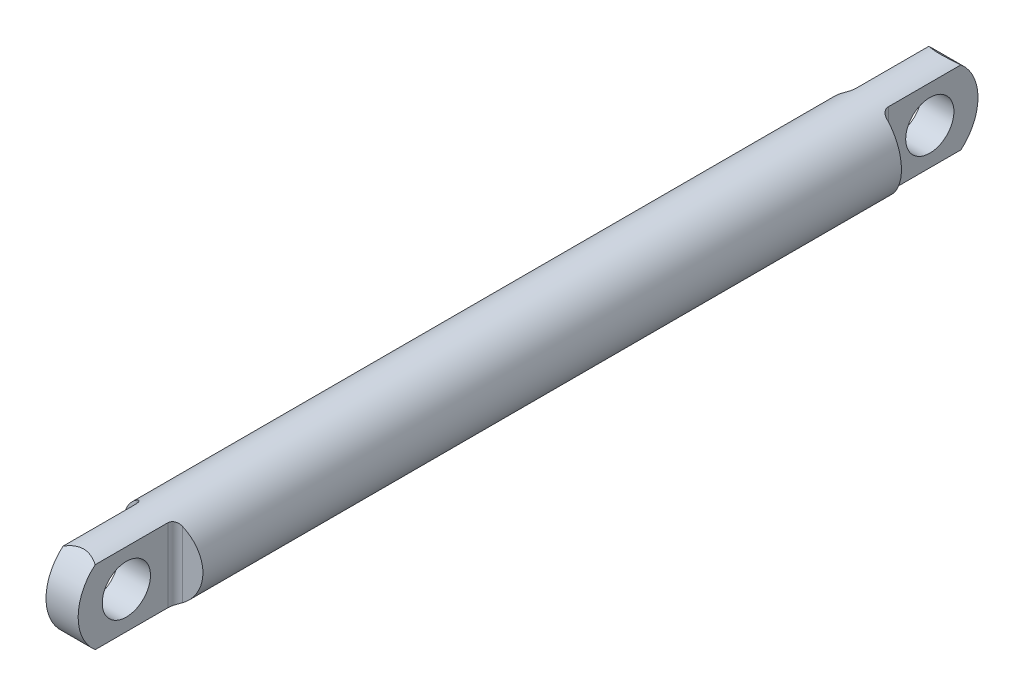
from build123d import *

# Parameters (mm, degrees)
SKETCH1_R            = 5
BOSS_EXTRUDE1_DEPTH  = 56
CUT_EXTRUDE2_DEPTH   = 57.444663167
CUT_EXTRUDE3_DEPTH   = 57.444663284
SKETCH8_R            = 3
CUT_EXTRUDE4_DEPTH   = 57.656862017
FILLET1_R            = 1
FILLET1_OF_MIRROR2_R = 1


with BuildPart() as part:
    # Sketch1 → Boss-Extrude1 (new, symmetric)
    with BuildSketch(Plane.XY):
        Circle(SKETCH1_R)
    extrude(amount=BOSS_EXTRUDE1_DEPTH, both=True)

    # Sketch6 → Cut-Extrude2 (cut, symmetric)
    with BuildSketch(Plane(origin=(0, 0, 0), x_dir=(0, 0, -1), z_dir=(1, 0, 0))):
        with BuildLine():
            Line((56, 0), (56, 5))
            Line((56, 5), (53.31662479, 5))
            ThreePointArc((53.31662479, 5), (55.286764074, 2.837274331), (56, 0))
        make_face()
        with BuildLine():
            Line((56, -5), (56, 0))
            ThreePointArc((56, 0), (55.286764074, -2.837274331), (53.31662479, -5))
            Line((53.31662479, -5), (56, -5))
        make_face()
    cut_extrude2 = extrude(amount=CUT_EXTRUDE2_DEPTH, both=True, mode=Mode.SUBTRACT)

    # Sketch7 → Cut-Extrude3 (cut, symmetric)
    with BuildSketch(Plane(origin=(0, 0, 0), x_dir=(1, 0, 0), z_dir=(0, 1, 0))):
        Polygon((-2, 56), (-2, 44), (-5, 43.471019058), (-5, 56), align=None)
        Polygon((5, 56), (2, 56), (2, 44), (5, 43.471019058), align=None)
    cut_extrude3 = extrude(amount=CUT_EXTRUDE3_DEPTH, both=True, mode=Mode.SUBTRACT)

    # Sketch8 → Cut-Extrude4 (cut, symmetric)
    with BuildSketch(Plane(origin=(-2, 0, 0), x_dir=(0, 0, -1), z_dir=(1, 0, 0))):
        with Locations((50, 0)):
            Circle(SKETCH8_R)
    cut_extrude4 = extrude(amount=CUT_EXTRUDE4_DEPTH, both=True, mode=Mode.SUBTRACT)

    # Fillet1
    fillet1_edges = [part.edges().sort_by_distance(p)[0] for p in [
        (-2, 0, -44),
        (2, 0, -44),
    ]]
    fillet(fillet1_edges, radius=FILLET1_R)

    # Mirror2: Cut-Extrude2, Cut-Extrude3, Cut-Extrude4 across plane
    add(cut_extrude2.mirror(Plane.XY), mode=Mode.SUBTRACT)
    add(cut_extrude3.mirror(Plane.XY), mode=Mode.SUBTRACT)
    add(cut_extrude4.mirror(Plane.XY), mode=Mode.SUBTRACT)

    # Fillet1 of Mirror2
    fillet1_of_mirror2_edges = [part.edges().sort_by_distance(p)[0] for p in [
        (-2, 0, 44),
        (2, 0, 44),
    ]]
    fillet(fillet1_of_mirror2_edges, radius=FILLET1_OF_MIRROR2_R)


solid = part.part
